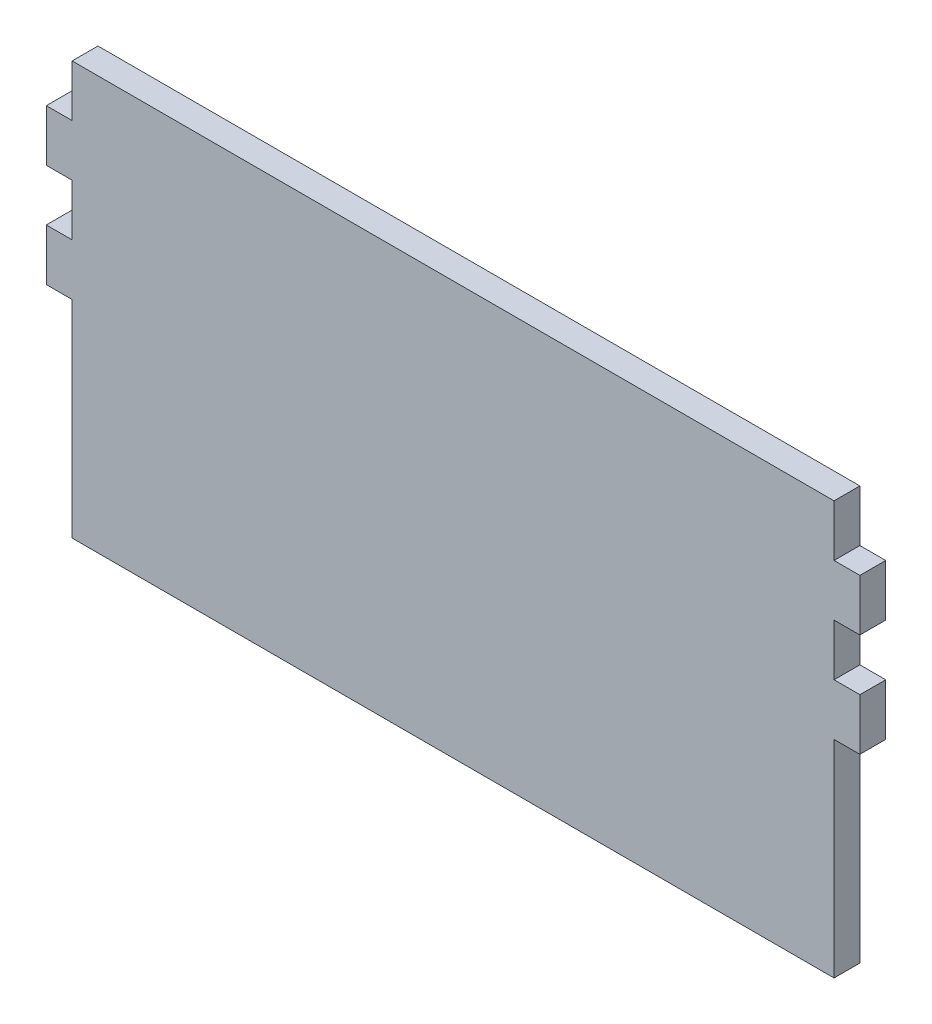
from build123d import *

# Parameters (mm, degrees)
BOSS_EXTRUDE1_DEPTH = 3.175


with BuildPart() as part:
    # Sketch1 → Boss-Extrude1 (new, symmetric)
    with BuildSketch(Plane.XY):
        Polygon((-93.6625, 50.8), (-93.6625, 38.1), (-100.0125, 38.1), (-100.0125, 25.4), (-93.6625, 25.4), (-93.6625, 12.7), (-100.0125, 12.7), (-100.0125, 0), (-93.6625, 0), (-93.6625, -50.8), (93.6625, -50.8), (93.6625, 0), (100.0125, 0), (100.0125, 12.7), (93.6625, 12.7), (93.6625, 25.4), (100.0125, 25.4), (100.0125, 38.1), (93.6625, 38.1), (93.6625, 50.8), align=None)
    extrude(amount=BOSS_EXTRUDE1_DEPTH, both=True)


solid = part.part
